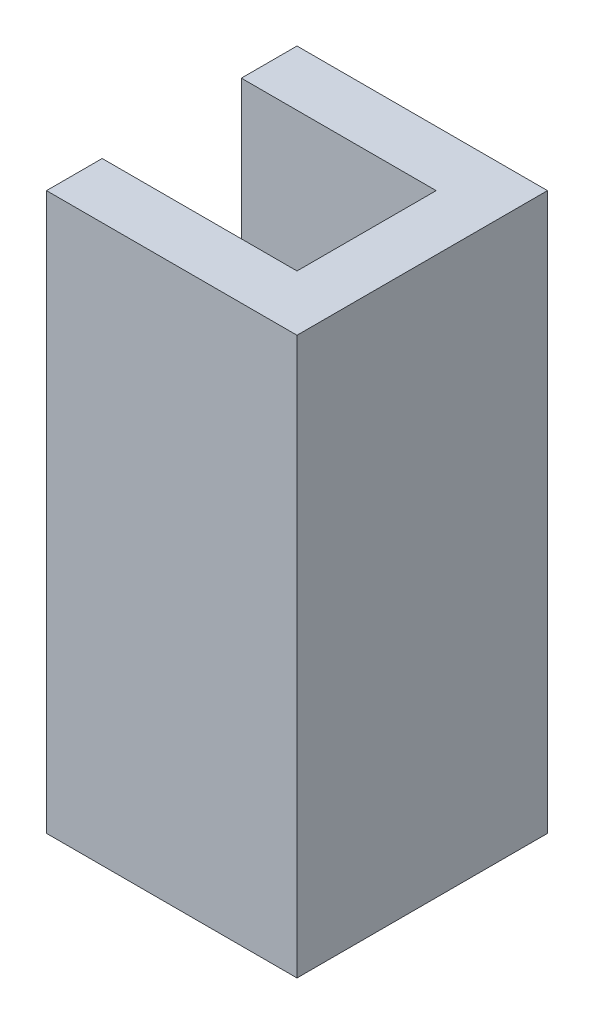
from build123d import *

# Parameters (mm, degrees)
SKETCH1_W           = 9
SKETCH1_H           = 9
SKETCH1_W_2         = 5
SKETCH1_H_2         = 5
BOSS_EXTRUDE1_DEPTH = 20
SKETCH2_W           = 2
SKETCH2_H           = 5
CUT_EXTRUDE1_DEPTH  = 21.988091862


with BuildPart() as part:
    # Sketch1 → Boss-Extrude1 (new body)
    with BuildSketch(Plane(origin=(0, 0, 0), x_dir=(1, 0, 0), z_dir=(0, 1, 0))):
        Rectangle(SKETCH1_W, SKETCH1_H)
        Rectangle(SKETCH1_W_2, SKETCH1_H_2, mode=Mode.SUBTRACT)
    extrude(amount=BOSS_EXTRUDE1_DEPTH)

    # Sketch2 → Cut-Extrude1 (cut, through all)
    with BuildSketch(Plane(origin=(0, 20, 0), x_dir=(1, 0, 0), z_dir=(0, 1, 0))):
        with Locations((-3.5, 0)):
            Rectangle(SKETCH2_W, SKETCH2_H)
    extrude(amount=-CUT_EXTRUDE1_DEPTH, mode=Mode.SUBTRACT)


solid = part.part
